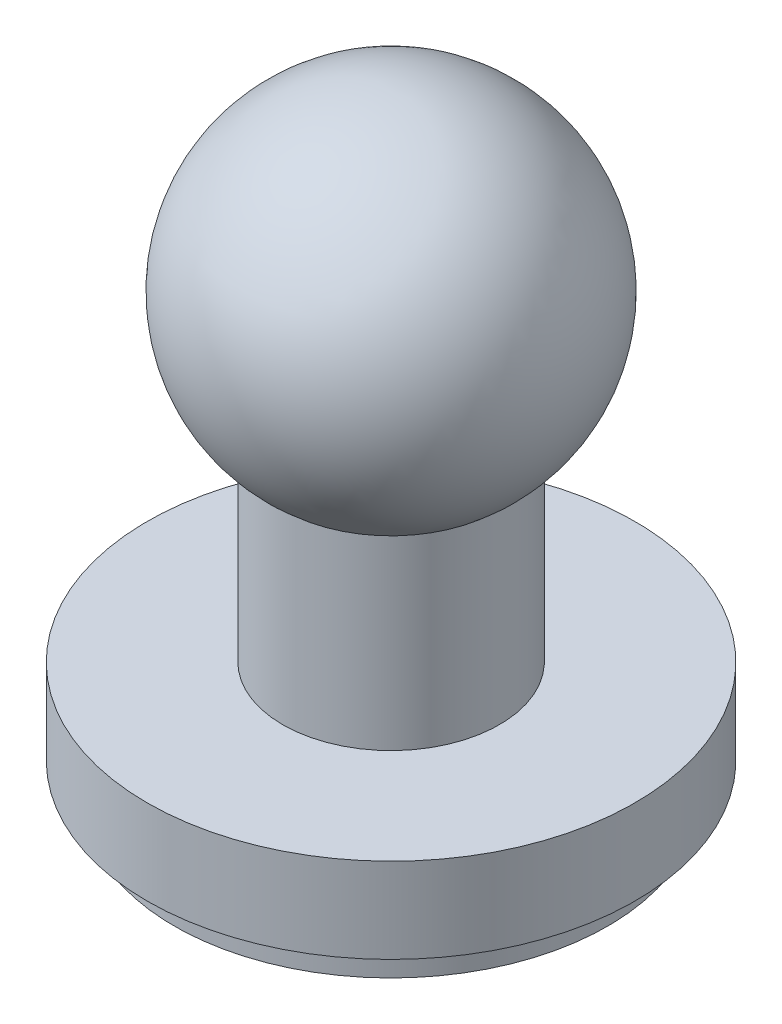
from build123d import *

# Parameters (mm, degrees)
SKETCH1_R           = 4.5
BOSS_EXTRUDE1_DEPTH = 1.57
SKETCH2_R           = 2
BOSS_EXTRUDE2_DEPTH = 5.93
SKETCH4_R           = 4
BOSS_EXTRUDE3_DEPTH = 0.65


with BuildPart() as part:
    # Sketch1 → Boss-Extrude1 (new body)
    with BuildSketch(Plane(origin=(0, 0, 0), x_dir=(1, 0, 0), z_dir=(0, 1, 0))):
        with Locations(Location((0, 0, 0), (0, 0, 270))):
            Circle(SKETCH1_R)
    extrude(amount=BOSS_EXTRUDE1_DEPTH)

    # Sketch2 → Boss-Extrude2 (add)
    with BuildSketch(Plane(origin=(0, 1.57, 0), x_dir=(1, 0, 0), z_dir=(0, 1, 0))):
        with Locations(Location((0, 0, 0), (0, 0, 270))):
            Circle(SKETCH2_R)
    extrude(amount=BOSS_EXTRUDE2_DEPTH)

    # Sketch3 → Revolve1 (revolve)
    with BuildSketch(Plane(origin=(0, 7.5, 0), x_dir=(1, 0, 0), z_dir=(0, 1, 0))):
        with BuildLine():
            Line((0, 3.2), (0, -3.2))
            ThreePointArc((0, -3.2), (3.2, 0), (0, 3.2))
        make_face()
    revolve(axis=Axis((0, 7.5, -8.311953328), (0, 0, 1)))

    # Sketch4 → Boss-Extrude3 (add)
    with BuildSketch(Plane.XZ):
        with Locations(Location((0, 0, 0), (0, 0, 270))):
            Circle(SKETCH4_R)
    extrude(amount=BOSS_EXTRUDE3_DEPTH)


solid = part.part
